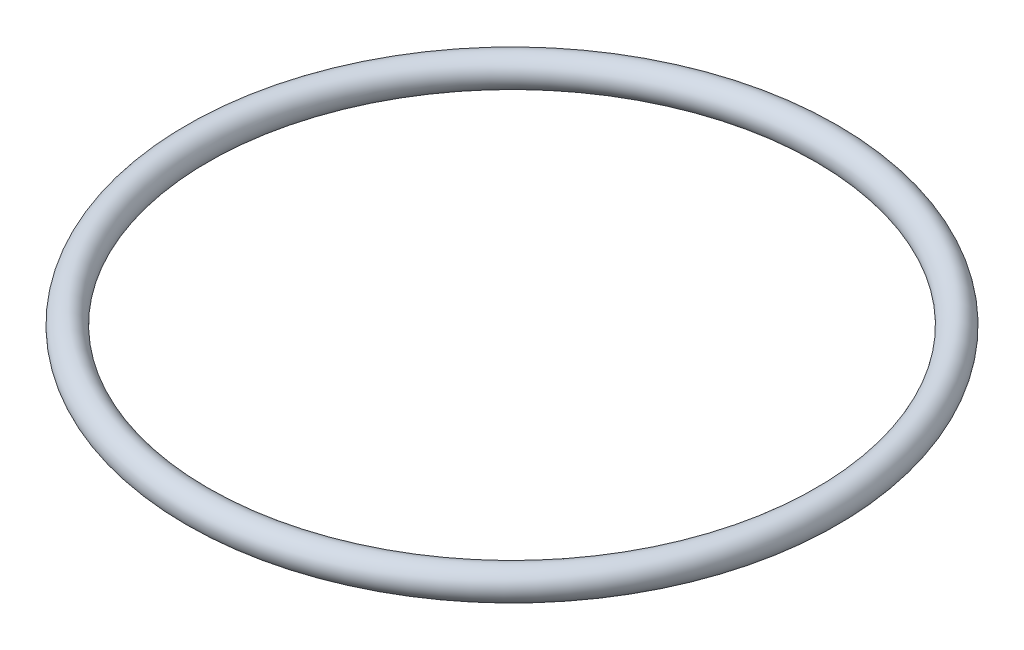
from build123d import *

# Parameters (mm, degrees)
CROQUIS1_R = 1.31


with BuildPart() as part:
    # Croquis1 → Revolución1 (revolve)
    with BuildSketch(Plane(origin=(0, 0, 0), x_dir=(0, 0, -1), z_dir=(1, 0, 0))):
        Circle(CROQUIS1_R)
    revolve(axis=Axis((0, 6.361439394, 27.345), (0, -1, 0)))


solid = part.part
